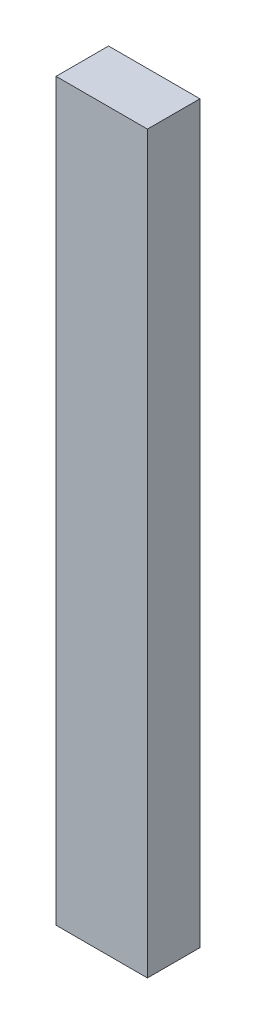
from build123d import *

# Parameters (mm, degrees)
SKETCH2_W           = 8.7
SKETCH2_H           = 5
BOSS_EXTRUDE1_DEPTH = 70


with BuildPart() as part:
    # Sketch2 → Boss-Extrude1 (new body)
    with BuildSketch(Plane(origin=(0, 0, 0), x_dir=(1, 0, 0), z_dir=(0, 1, 0))):
        Rectangle(SKETCH2_W, SKETCH2_H)
    extrude(amount=BOSS_EXTRUDE1_DEPTH)


solid = part.part
